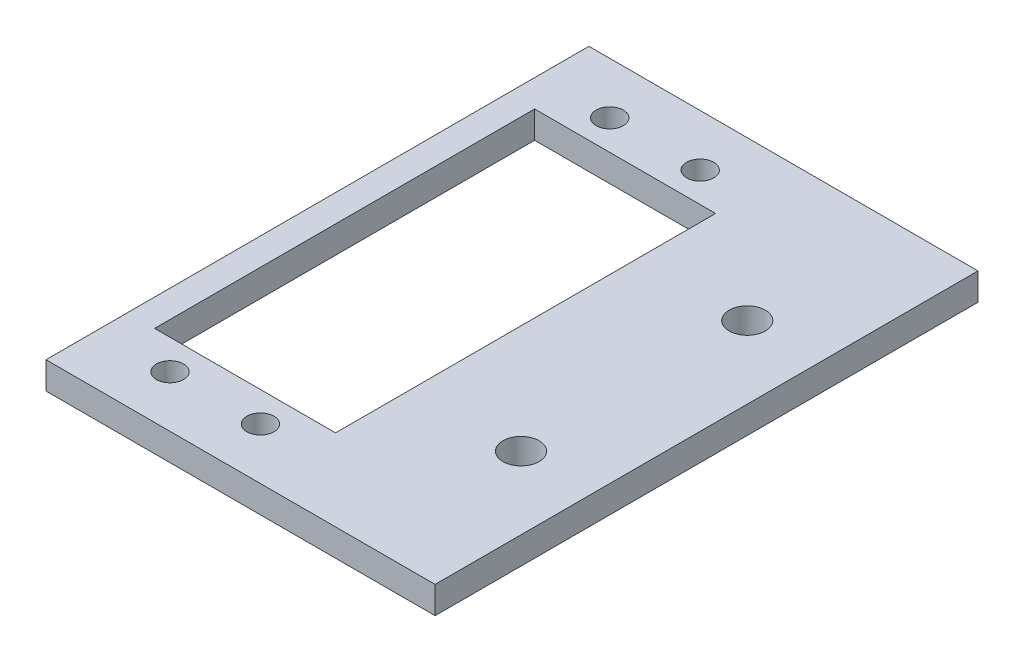
from build123d import *

# Parameters (mm, degrees)
SKETCH_1_W      = 43
SKETCH_1_H      = 60
SKETCH_1_R      = 1.5
SKETCH_1_R_2    = 2
SKETCH_1_W_2    = 20
SKETCH_1_H_2    = 42
EXTRUDE_1_DEPTH = 3


with BuildPart() as part:
    # 草图1 → 凸台-拉伸1 (new body)
    with BuildSketch(Plane(origin=(0, 0, 0), x_dir=(1, 0, 0), z_dir=(0, 1, 0))):
        with Locations((21.5, -30)):
            Rectangle(SKETCH_1_W, SKETCH_1_H)
        with Locations(Location((8, -5.7, 0), (0, 0, 270))):
            Circle(SKETCH_1_R, mode=Mode.SUBTRACT)
        with Locations(Location((18, -5.7, 0), (0, 0, 270))):
            Circle(SKETCH_1_R, mode=Mode.SUBTRACT)
        with Locations(Location((8, -54.3, 0), (0, 0, 270))):
            Circle(SKETCH_1_R, mode=Mode.SUBTRACT)
        with Locations(Location((18, -54.3, 0), (0, 0, 270))):
            Circle(SKETCH_1_R, mode=Mode.SUBTRACT)
        with Locations(Location((35, -17.5, 0), (0, 0, 270))):
            Circle(SKETCH_1_R_2, mode=Mode.SUBTRACT)
        with Locations(Location((35, -42.5, 0), (0, 0, 270))):
            Circle(SKETCH_1_R_2, mode=Mode.SUBTRACT)
        with Locations((13, -30)):
            Rectangle(SKETCH_1_W_2, SKETCH_1_H_2, mode=Mode.SUBTRACT)
    extrude(amount=EXTRUDE_1_DEPTH)


solid = part.part
